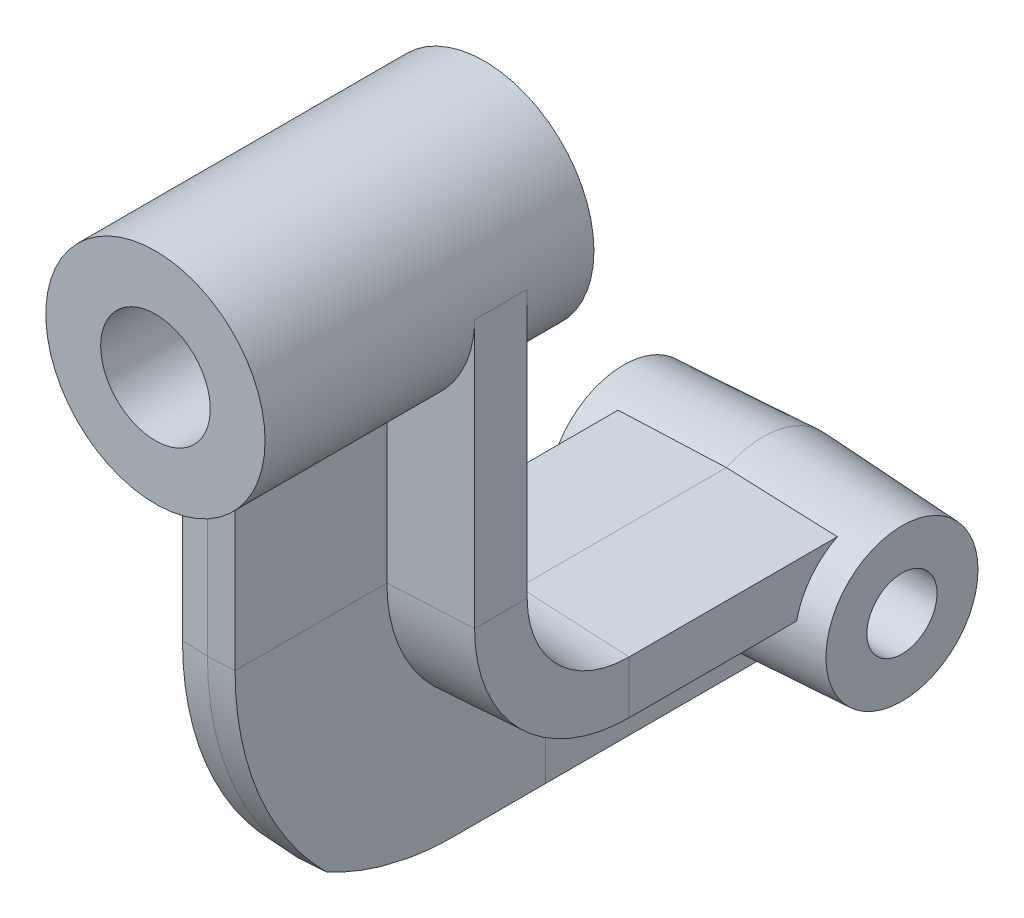
from build123d import *

# Parameters (mm, degrees)
SKETCH1_R                     = 25
BOSS_EXTRUDE1_DEPTH           = 75
SKETCH2_R                     = 19
BOSS_EXTRUDE2_DEPTH           = 31.75
BOSS_EXTRUDE2_TAPER           = 3
BOSS_EXTRUDE2_OTHER_WAY_DEPTH = 31.75
BOSS_EXTRUDE2_OTHER_WAY_TAPER = 3
CUT_EXTRUDE2_DEPTH            = 161.296002109
CUT_EXTRUDE3_DEPTH            = 161.296002109
SKETCH14_R                    = 12.5
CUT_EXTRUDE4_DEPTH            = 149.240724994
SKETCH16_R                    = 8
CUT_EXTRUDE5_DEPTH            = 159.112302029


with BuildPart() as part:
    # Sketch1 → Boss-Extrude1 (new body)
    with BuildSketch(Plane.XY):
        Circle(SKETCH1_R)
    extrude(amount=BOSS_EXTRUDE1_DEPTH)



with BuildPart() as body_2:
    # Sketch2 → Boss-Extrude2 (new body)
    with BuildSketch(Plane(origin=(0, 0, 0), x_dir=(0, 0, -1), z_dir=(1, 0, 0))):
        with Locations((63.5, -100)):
            Circle(SKETCH2_R)
    extrude(amount=BOSS_EXTRUDE2_DEPTH, taper=BOSS_EXTRUDE2_TAPER)

    # Sketch2 → Boss-Extrude2 other way (add)
    with BuildSketch(Plane(origin=(0, 0, 0), x_dir=(0, 0, -1), z_dir=(1, 0, 0))):
        with Locations((63.5, -100)):
            Circle(SKETCH2_R)
    extrude(amount=-BOSS_EXTRUDE2_OTHER_WAY_DEPTH, taper=BOSS_EXTRUDE2_OTHER_WAY_TAPER)


with BuildPart() as part_1:
    add(part.part)

    add(body_2.part)  # Sweep2 merges body 2
    # Sweep2: sweep along a path in Sketch5
    with BuildLine(Plane(origin=(0, 0, 0), x_dir=(0, 0, -1), z_dir=(1, 0, 0))) as sweep2_path:
        Line((63.5, -81), (8, -81))
        ThreePointArc((8, -81), (-6.142135624, -75.142135624), (-12, -61))
        Line((-12, -61), (-12, 0))
    # Sketch6 → Sweep2 (sweep)
    with BuildSketch(Plane(origin=(0, 0, 0), x_dir=(1, 0, 0), z_dir=(0, 1, 0))):
        Polygon((0, -63.149520499), (-6, -62.835073823), (-6, -28.216088806), (-25, -27.220340999), (-25, -15.220340999), (0, -13.910146517), (25, -15.220340999), (25, -27.220340999), (6, -28.216088806), (6, -62.835073823), align=None)
    sweep(path=sweep2_path.line)

    # Sketch11 → Cut-Extrude2 (cut, through all)
    with BuildSketch(Plane(origin=(6, 0, 0), x_dir=(0, 0, -1), z_dir=(1, 0, 0))):
        with BuildLine():
            Line((63.5, -118.685553324), (-12.864893702, -118.685553324))
            ThreePointArc((-12.864893702, -118.685553324), (-27.962170554, -116.755099832), (-42.087961046, -111.087961046))
            ThreePointArc((-42.087961046, -111.087961046), (-19.107409182, -126.443074889), (8, -131.835073823))
            Line((8, -131.835073823), (63.5, -131.835073823))
            Line((63.5, -131.835073823), (63.5, -118.685553324))
        make_face()
    extrude(amount=-CUT_EXTRUDE2_DEPTH, mode=Mode.SUBTRACT)

    # Sketch13 → Cut-Extrude3 (cut, through all)
    with BuildSketch(Plane(origin=(6, 0, 0), x_dir=(0, 0, -1), z_dir=(1, 0, 0))):
        with BuildLine():
            Line((-45.200625265, -110.295779466), (-42.087961046, -111.087961046))
            ThreePointArc((-42.087961046, -111.087961046), (-36.02411738, -114.035804983), (-29.667824287, -116.28469849))
            Line((-29.667824287, -116.28469849), (-23.461340117, -117.742435424))
            Line((-23.461340117, -117.742435424), (44.847812883, -128.347311627))
            Line((44.847812883, -128.347311627), (71.018240587, -129.970040241))
            Line((71.018240587, -129.970040241), (72.328139591, -135.750206771))
            Line((72.328139591, -135.750206771), (-4.743995253, -135.750206771))
            Line((-4.743995253, -135.750206771), (-39.71664546, -116.755099832))
            Line((-39.71664546, -116.755099832), (-45.200625265, -110.295779466))
        make_face()
    extrude(amount=-CUT_EXTRUDE3_DEPTH, mode=Mode.SUBTRACT)

    # Sketch14 → Cut-Extrude4 (cut, through all)
    with BuildSketch(Plane(origin=(0, 0, 0), x_dir=(-1, 0, 0), z_dir=(0, 0, -1))):
        Circle(SKETCH14_R)
    extrude(amount=-CUT_EXTRUDE4_DEPTH, mode=Mode.SUBTRACT)

    # Sketch16 → Cut-Extrude5 (cut, through all)
    with BuildSketch(Plane.ZY.offset(31.75)):
        with Locations((-63.5, -100)):
            Circle(SKETCH16_R)
    extrude(amount=-CUT_EXTRUDE5_DEPTH, mode=Mode.SUBTRACT)


solid = part_1.part
